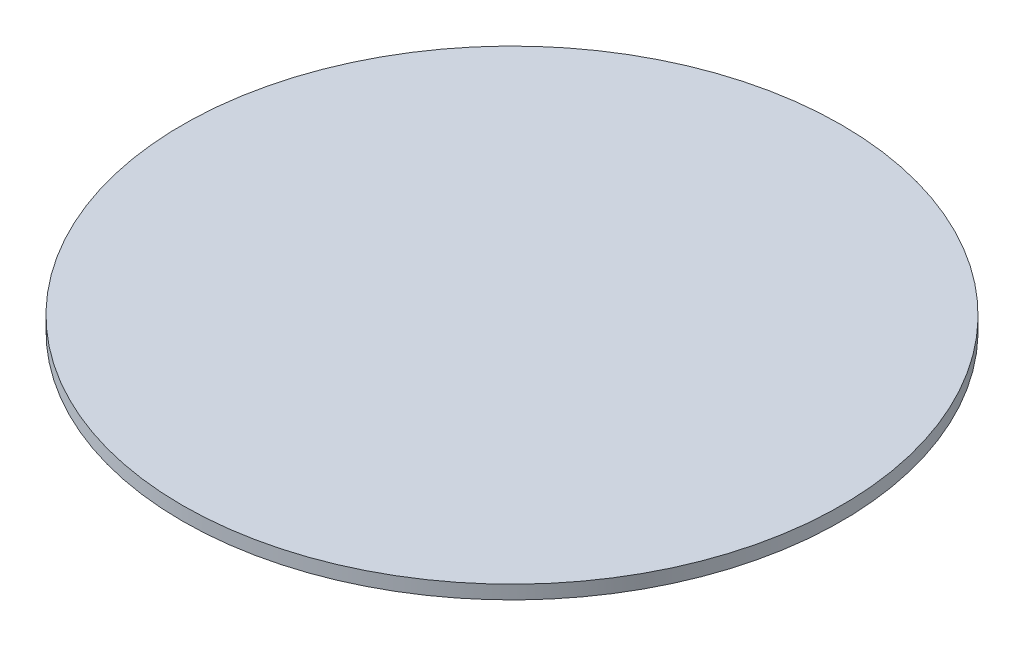
from build123d import *

# Parameters (mm, degrees)
SKETCH1_R           = 14.5
BOSS_EXTRUDE1_DEPTH = 0.6


with BuildPart() as part:
    # Sketch1 → Boss-Extrude1 (new body)
    with BuildSketch(Plane(origin=(0, 0, 0), x_dir=(1, 0, 0), z_dir=(0, 1, 0))):
        with Locations(Location((0, 0, 0), (0, 0, 270))):
            Circle(SKETCH1_R)
    extrude(amount=BOSS_EXTRUDE1_DEPTH)


solid = part.part
